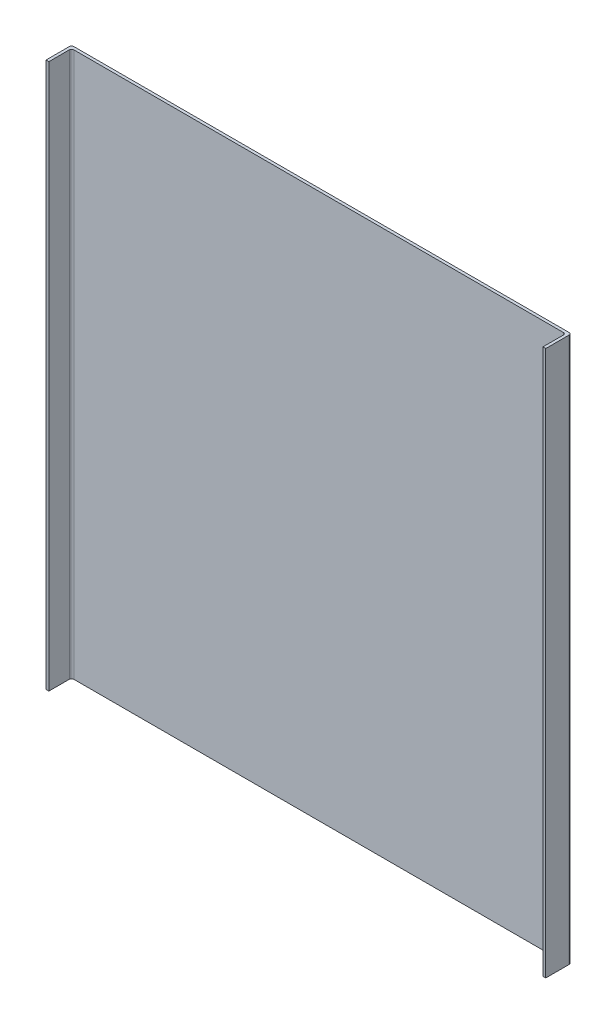
from build123d import *

# Parameters (mm, degrees)
SKETCH1_W           = 1117.6
SKETCH1_H           = 1219.2
BOSS_EXTRUDE1_DEPTH = 6.35
SKETCH2_W           = 6.35
SKETCH2_H           = 1219.2
BOSS_EXTRUDE2_DEPTH = 50.8
FILLET1_R           = 5


with BuildPart() as part:
    # Sketch1 → Boss-Extrude1 (new body)
    with BuildSketch(Plane.XY):
        with Locations((558.8, 609.6)):
            Rectangle(SKETCH1_W, SKETCH1_H)
    extrude(amount=BOSS_EXTRUDE1_DEPTH)

    # Sketch2 → Boss-Extrude2 (add)
    with BuildSketch(Plane.XY.offset(6.35)):
        with Locations((3.175, 609.6)):
            Rectangle(SKETCH2_W, SKETCH2_H)
        with Locations((1114.425, 609.6)):
            Rectangle(SKETCH2_W, SKETCH2_H)
    extrude(amount=BOSS_EXTRUDE2_DEPTH)

    # Fillet1
    fillet1_edges = [part.edges().sort_by_distance(p)[0] for p in [
        (6.35, 609.6, 6.35),
        (1111.25, 609.6, 6.35),
        (1117.6, 609.6, 0),
        (0, 609.6, 0),
    ]]
    fillet(fillet1_edges, radius=FILLET1_R)


solid = part.part
